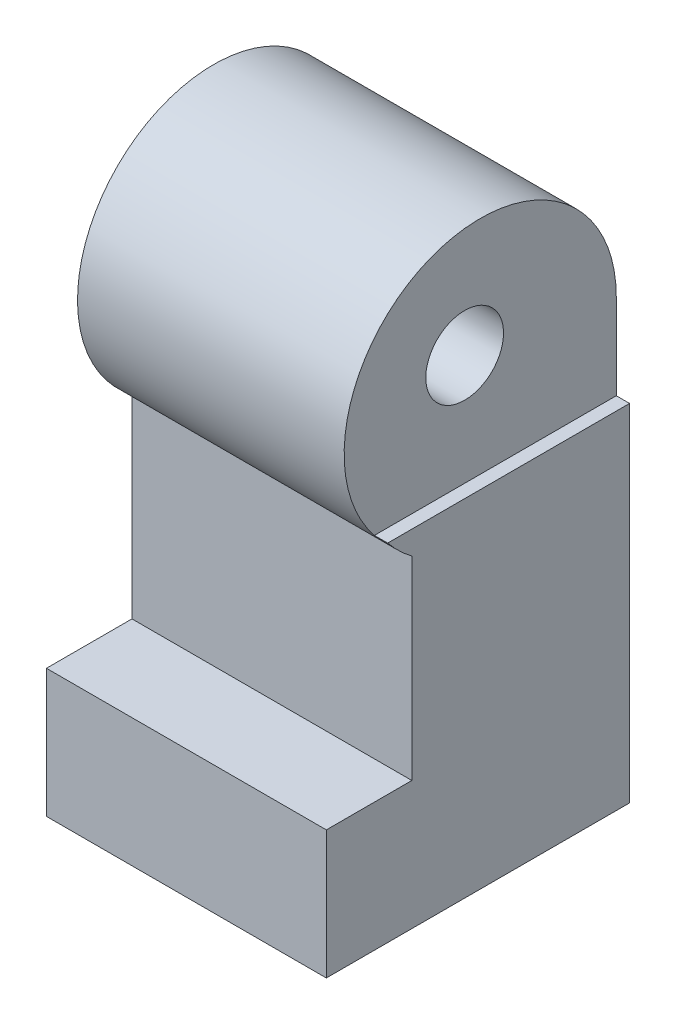
from build123d import *

# Parameters (mm, degrees)
SALIENTE_EXTRUIR1_DEPTH    = 10.8
CORTAR_EXTRUIR1_DEPTH      = 28.076558127
CORTAR_EXTRUIR1_DEPTH_BACK = 28.076558127
CROQUIS4_W                 = 1.025
CROQUIS4_H                 = 17.1
CORTAR_EXTRUIR2_DEPTH      = 33.246404838
CORTAR_EXTRUIR2_DEPTH_BACK = 6.425
CROQUIS5_R                 = 3


with BuildPart() as part:
    # Croquis3 → Saliente-Extruir1 (new, symmetric)
    with BuildSketch(Plane(origin=(0, 0, 0), x_dir=(0, 0, -1), z_dir=(1, 0, 0))):
        with BuildLine():
            Line((11.7, 11.4), (11.7, -21.9))
            Line((11.7, -21.9), (-11.7, -21.9))
            Line((-11.7, -21.9), (-11.7, -12))
            Line((-11.7, -12), (-5.1, -12))
            Line((-5.1, -12), (-5.1, 3))
            ThreePointArc((-5.1, 3), (-3.495742753, 20.791485505), (11.7, 11.4))
        make_face()
    extrude(amount=SALIENTE_EXTRUIR1_DEPTH, both=True)

    # Croquis4 → Cortar-Extruir1 (cut, two sides: drawn at the far end of the back side and taken through both)
    with BuildSketch(Plane.XY.offset(-CORTAR_EXTRUIR1_DEPTH_BACK)):
        with Locations((10.2875, 13.35)):
            Rectangle(CROQUIS4_W, CROQUIS4_H)
    extrude(amount=CORTAR_EXTRUIR1_DEPTH + CORTAR_EXTRUIR1_DEPTH_BACK, mode=Mode.SUBTRACT)

    # Croquis5 → Cortar-Extruir2 (cut, two sides: drawn at the far end of the back side and taken through both)
    with BuildSketch(Plane(origin=(9.775, 0, 0), x_dir=(0, 0, -1), z_dir=(1, 0, 0)).offset(-CORTAR_EXTRUIR2_DEPTH_BACK)):
        with Locations(Location((0, 13.35, 0), (0, 0, 270))):
            Circle(CROQUIS5_R)
    extrude(amount=CORTAR_EXTRUIR2_DEPTH + CORTAR_EXTRUIR2_DEPTH_BACK, mode=Mode.SUBTRACT)


solid = part.part
